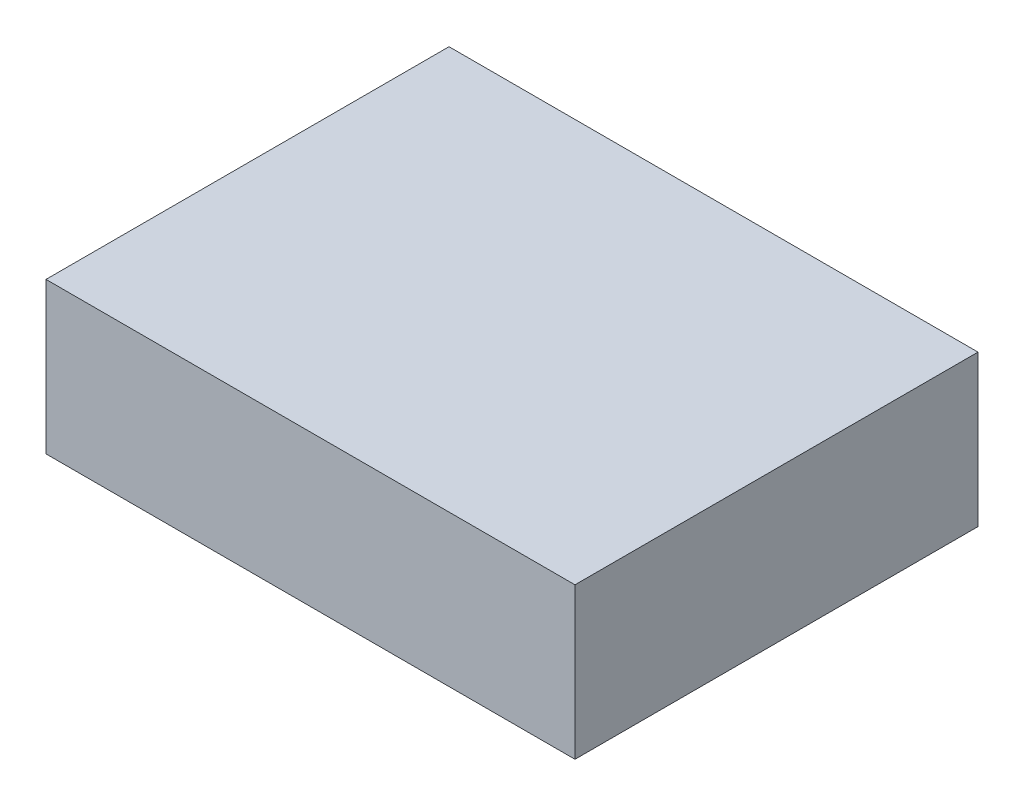
from build123d import *

# Parameters (mm, degrees)
SKETCH3_W           = 42
SKETCH3_H           = 12
BOSS_EXTRUDE1_DEPTH = 32


with BuildPart() as part:
    # Sketch3 → Boss-Extrude1 (new body)
    with BuildSketch(Plane.XY):
        Rectangle(SKETCH3_W, SKETCH3_H)
    extrude(amount=-BOSS_EXTRUDE1_DEPTH)


solid = part.part
